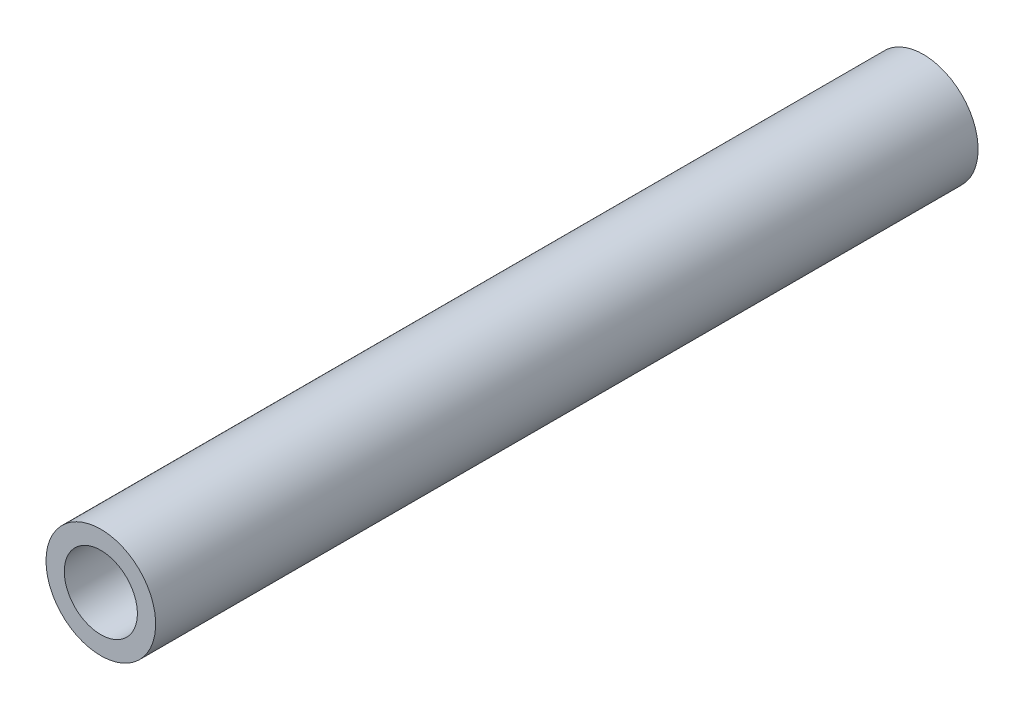
from build123d import *

# Parameters (mm, degrees)
SCHIZZO1_R                   = 3
SCHIZZO1_R_2                 = 2
ESTRUSIONE_ESTRUSIONE1_DEPTH = 45


with BuildPart() as part:
    # Schizzo1 → Estrusione-Estrusione1 (new body)
    with BuildSketch(Plane.XY):
        with Locations(Location((75, -87.5, 0), (0, 0, 180))):
            Circle(SCHIZZO1_R)
        with Locations(Location((75, -87.5, 0), (0, 0, 180))):
            Circle(SCHIZZO1_R_2, mode=Mode.SUBTRACT)
    extrude(amount=ESTRUSIONE_ESTRUSIONE1_DEPTH)


solid = part.part
